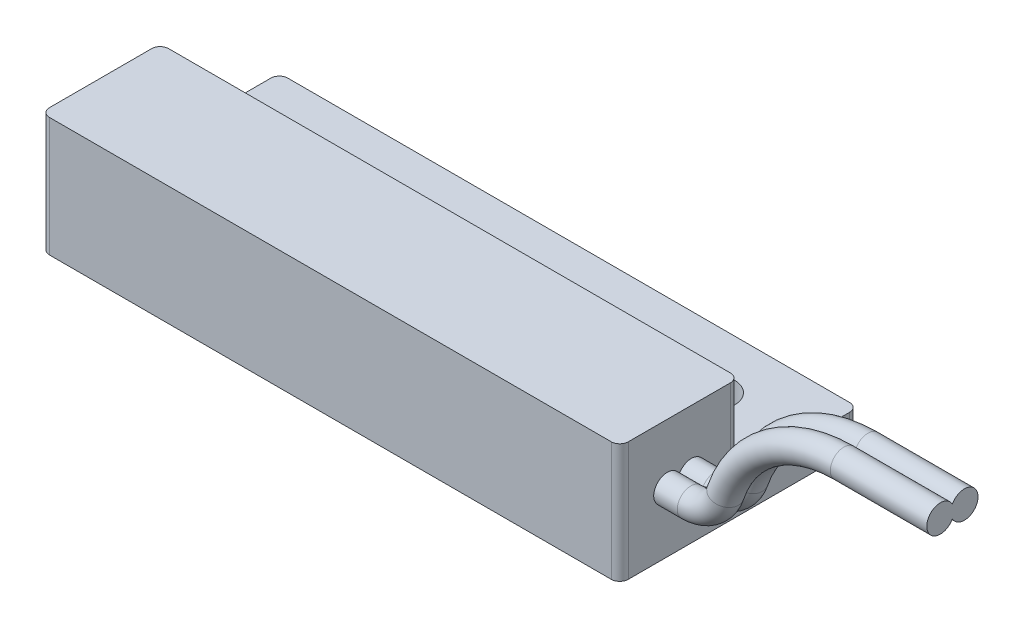
from build123d import *

# Parameters (mm, degrees)
SKETCH1_W           = 34
SKETCH1_H           = 14
BOSS_EXTRUDE1_DEPTH = 2
SKETCH2_W           = 34
SKETCH2_H           = 7
BOSS_EXTRUDE2_DEPTH = 5
FILLET1_R           = 0.5
CUT_EXTRUDE1_REACH  = 21.053
SKETCH3_R           = 1.25


with BuildPart() as part:
    # Sketch1 → Boss-Extrude1 (new body)
    with BuildSketch(Plane(origin=(0, 0, 0), x_dir=(1, 0, 0), z_dir=(0, 1, 0))):
        Rectangle(SKETCH1_W, SKETCH1_H)
    extrude(amount=BOSS_EXTRUDE1_DEPTH)

    # Sketch2 → Boss-Extrude2 (add)
    with BuildSketch(Plane(origin=(0, 2, 0), x_dir=(1, 0, 0), z_dir=(0, 1, 0))):
        with Locations((0, -3.5)):
            Rectangle(SKETCH2_W, SKETCH2_H)
    extrude(amount=BOSS_EXTRUDE2_DEPTH)

    # Fillet1
    fillet1_edges = [part.edges().sort_by_distance(p)[0] for p in [
        (17, 4.5, 0),
        (-17, 4.5, 0),
        (17, 3.5, 7),
        (-17, 3.5, 7),
        (-17, 1, -7),
        (17, 1, -7),
    ]]
    fillet(fillet1_edges, radius=FILLET1_R)

    # Sketch3 → Cut-Extrude1 (cut, up to next)
    with BuildSketch(Plane(origin=(0, 2, 0), x_dir=(1, 0, 0), z_dir=(0, 1, 0)), mode=Mode.PRIVATE) as cut_extrude1_sk1:
        with Locations(Location((12, 3.5, 0), (0, 0, 270))):
            Circle(SKETCH3_R)
    cut_extrude1_tool1 = extrude(cut_extrude1_sk1.sketch, amount=-CUT_EXTRUDE1_REACH, mode=Mode.PRIVATE) & part.part
    # Sketch3 → Cut-Extrude1 (cut, up to next)
    with BuildSketch(Plane(origin=(0, 2, 0), x_dir=(1, 0, 0), z_dir=(0, 1, 0)), mode=Mode.PRIVATE) as cut_extrude1_sk2:
        with Locations(Location((-12, 3.5, 0), (0, 0, 270))):
            Circle(SKETCH3_R)
    cut_extrude1_tool2 = extrude(cut_extrude1_sk2.sketch, amount=-CUT_EXTRUDE1_REACH, mode=Mode.PRIVATE) & part.part
    add(cut_extrude1_tool1.solids().sort_by_distance((12, 2, -3.5))[0], mode=Mode.SUBTRACT)
    add(cut_extrude1_tool2.solids().sort_by_distance((-12, 2, -3.5))[0], mode=Mode.SUBTRACT)

    # Sweep1: sweep along a path in Sketch5
    with BuildLine(Plane.XY.offset(3.5)) as sweep1_path:
        Line((17, 3.5), (18.382578008, 3.5))
        ThreePointArc((18.382578008, 3.5), (19.635477623, 3.904030935), (20.416306226, 4.963891838))
        ThreePointArc((20.416306226, 4.963891838), (23.087486641, 8.589629512), (27.373601284, 9.971801625))
        Line((27.373601284, 9.971801625), (33.038157501, 9.971801625))
    # Sketch4 → Sweep1 (sweep)
    with BuildSketch(Plane(origin=(17, 0, 0), x_dir=(0, 0, -1), z_dir=(1, 0, 0))):
        with BuildLine():
            ThreePointArc((-3.5, 3.874862619), (-5.006737587, 3.5), (-3.5, 3.125137381))
            ThreePointArc((-3.5, 3.125137381), (-1.993262413, 3.5), (-3.5, 3.874862619))
        make_face()
    sweep(path=sweep1_path.line)


solid = part.part
